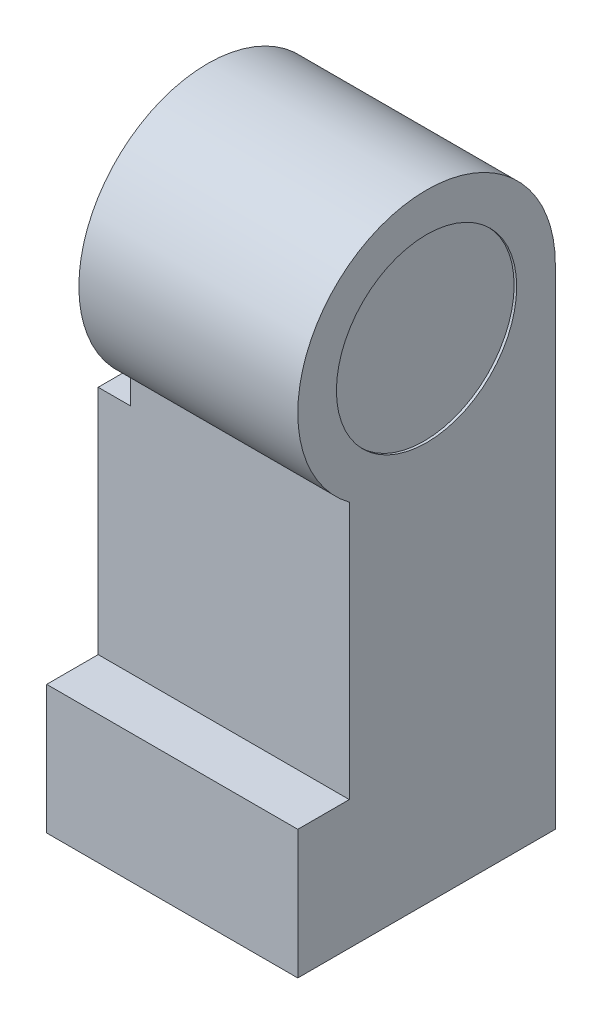
from build123d import *

# Parameters (mm, degrees)
SKETCH1_W                                      = 10
SKETCH1_H                                      = 10
FOOT_DEPTH                                     = 5
SKETCH2_W                                      = 10
SKETCH2_H                                      = 8
LEG_DEPTH                                      = 14
SKETCH3_R                                      = 5
HIP_CONECTOR_DEPTH                             = 10
SKETCH28_R                                     = 3.5
DECORATIVE_CIRCLE_THAT_MAKES_THIS_EASY_T_DEPTH = 0.1
ROOM_FOR_HIP_DEPTH                             = 1.5
HIP_HOLE_D                                     = 4
HIP_HOLE_DEPTH                                 = 6
HIP_HOLE_TIP                                   = 1.201721238
SKETCH18_W                                     = 6
SKETCH18_H                                     = 6
FOOT_HOLE_DEPTH                                = 2.5
WEIGHT_REDUCTION_MAKE_IT_EASY_TO_ADD_CEN_D     = 3
WEIGHT_REDUCTION_MAKE_IT_EASY_TO_ADD_CEN_DEPTH = 8
WEIGHT_REDUCTION_MAKE_IT_EASY_TO_ADD_CEN_TIP   = 0.901290929
SKETCH27_W                                     = 10
SKETCH27_H                                     = 20
THIGH_GAP_DEPTH                                = 0.25
SCALE1_SCALE                                   = 2


with BuildPart() as part:
    # Sketch1 → Foot (new body)
    with BuildSketch(Plane(origin=(0, 0, 0), x_dir=(1, 0, 0), z_dir=(0, 1, 0))):
        with Locations((5, -5)):
            Rectangle(SKETCH1_W, SKETCH1_H)
    extrude(amount=FOOT_DEPTH)

    # Sketch2 → Leg (add)
    with BuildSketch(Plane(origin=(0, 5, 0), x_dir=(1, 0, 0), z_dir=(0, 1, 0))):
        with Locations((5, -4)):
            Rectangle(SKETCH2_W, SKETCH2_H)
    extrude(amount=LEG_DEPTH)

    # Sketch3 → Hip conector (add)
    with BuildSketch(Plane.ZY):
        with Locations((5, 19)):
            Circle(SKETCH3_R)
    extrude(amount=-HIP_CONECTOR_DEPTH)

    # Sketch28 → Decorative circle that makes this easy to dimension (cut)
    with BuildSketch(Plane(origin=(10, 0, 0), x_dir=(0, 0, -1), z_dir=(1, 0, 0))):
        with Locations((-5, 19)):
            Circle(SKETCH28_R)
    extrude(amount=-DECORATIVE_CIRCLE_THAT_MAKES_THIS_EASY_T_DEPTH, mode=Mode.SUBTRACT)

    # Sketch19 → Room for hip (cut)
    with BuildSketch(Plane.ZY):
        with BuildLine():
            Line((5, 13.99), (10, 13.99))
            Line((10, 13.99), (10, 24))
            Line((10, 24), (0, 24))
            Line((0, 24), (0, 16.101701649))
            Line((0, 16.101701649), (2.495, 14.661212727))
            ThreePointArc((2.495, 14.661212727), (3.703316584, 14.16071161), (5, 13.99))
        make_face()
    extrude(amount=-ROOM_FOR_HIP_DEPTH, mode=Mode.SUBTRACT)

    # Hip hole
    with Locations(Plane.ZY.offset(-1.5)):
        with Locations((5, 19)):
            Hole(HIP_HOLE_D / 2, depth=HIP_HOLE_DEPTH)
            with Locations((0, 0, -(HIP_HOLE_DEPTH + HIP_HOLE_TIP / 2))):  # 118° drill point
                Cone(0, HIP_HOLE_D / 2, HIP_HOLE_TIP, mode=Mode.SUBTRACT)

    # Sketch18 → Foot hole (cut)
    with BuildSketch(Plane.XZ):
        with Locations((5, 5)):
            Rectangle(SKETCH18_W, SKETCH18_H)
    extrude(amount=-FOOT_HOLE_DEPTH, mode=Mode.SUBTRACT)

    # Weight reduction/make it easy to add centerline hole
    with Locations(Plane(origin=(0, 2.5, 0), x_dir=(-1, 0, 0), z_dir=(0, -1, 0))):
        with Locations((-5, -5)):
            Hole(WEIGHT_REDUCTION_MAKE_IT_EASY_TO_ADD_CEN_D / 2, depth=WEIGHT_REDUCTION_MAKE_IT_EASY_TO_ADD_CEN_DEPTH)
            with Locations((0, 0, -(WEIGHT_REDUCTION_MAKE_IT_EASY_TO_ADD_CEN_DEPTH + WEIGHT_REDUCTION_MAKE_IT_EASY_TO_ADD_CEN_TIP / 2))):  # 118° drill point
                Cone(0, WEIGHT_REDUCTION_MAKE_IT_EASY_TO_ADD_CEN_D / 2, WEIGHT_REDUCTION_MAKE_IT_EASY_TO_ADD_CEN_TIP, mode=Mode.SUBTRACT)

    # Sketch27 → Thigh gap (cut)
    with BuildSketch(Plane.ZY):
        with Locations((5, 10)):
            Rectangle(SKETCH27_W, SKETCH27_H)
    extrude(amount=-THIGH_GAP_DEPTH, mode=Mode.SUBTRACT)


with BuildPart() as part_1:
    # Scale1: scaled about (5.400486536, 11.496150449, 4.477610723)
    add(part.part.scale(SCALE1_SCALE).moved(Location((-5.400486536, -11.496150449, -4.477610723))))


solid = part_1.part
